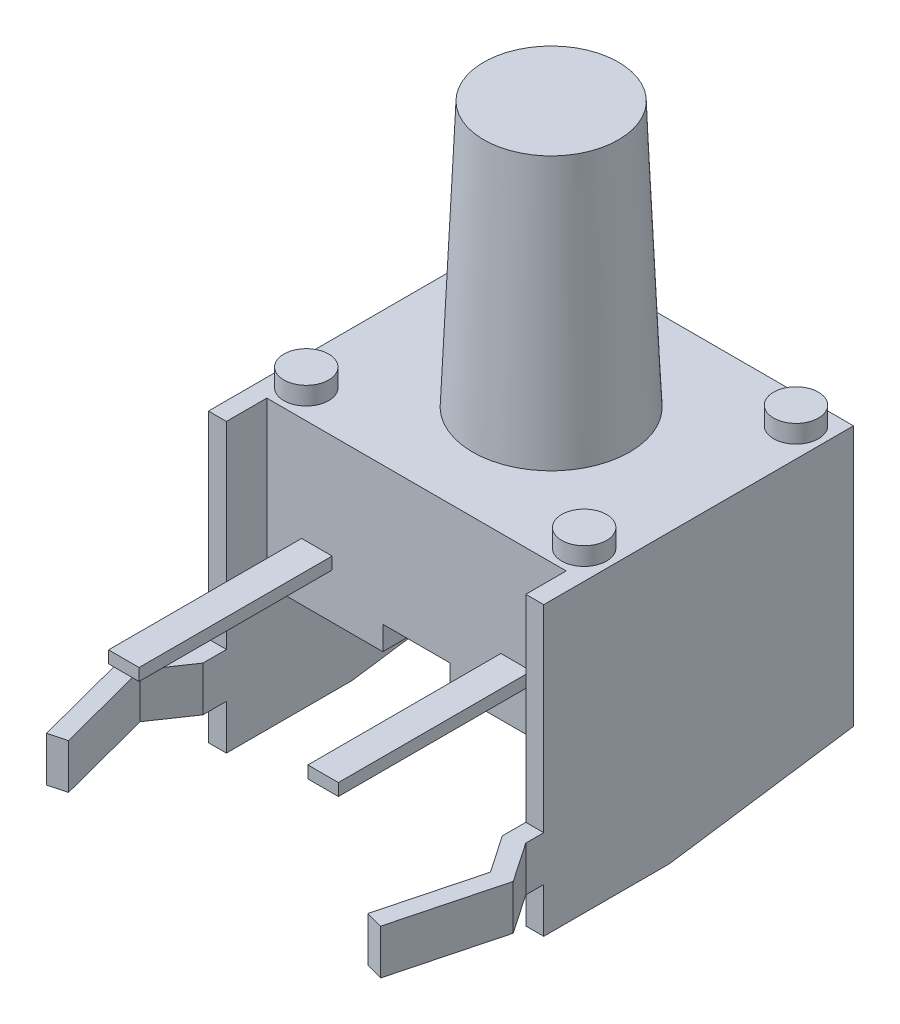
from build123d import *

# Parameters (mm, degrees)
SKETCH1_W           = 7
SKETCH1_H           = 6
BOSS_EXTRUDE1_DEPTH = 5.05
SKETCH3_W           = 0.68
SKETCH3_H           = 0.27
BOSS_EXTRUDE2_DEPTH = 4.3
SKETCH4_W           = 0.4
SKETCH4_H           = 5.8
BOSS_EXTRUDE3_DEPTH = 6.9
SKETCH6_W           = 6.67
SKETCH6_H           = 1.45
CUT_EXTRUDE1_DEPTH  = 13.06410896
CUT_EXTRUDE2_REACH  = 10.686
SKETCH7_W           = 1.5
SKETCH7_H           = 0.53
BOSS_EXTRUDE5_START = -3.6
SKETCH9_R           = 0.5
BOSS_EXTRUDE5_DEPTH = 4
BOSS_EXTRUDE6_DEPTH = 0.4
BOSS_EXTRUDE4_START = -1
BOSS_EXTRUDE4_DEPTH = 1


with BuildPart() as part:
    # Sketch1 → Boss-Extrude1 (new body)
    with BuildSketch(Plane(origin=(0, 0, 0), x_dir=(1, 0, 0), z_dir=(0, 1, 0))):
        Rectangle(SKETCH1_W, SKETCH1_H)
    extrude(amount=BOSS_EXTRUDE1_DEPTH)

    # Sketch3 → Boss-Extrude2 (add)
    with BuildSketch(Plane.XY.offset(3)):
        with Locations((-2.22, 2.595)):
            Rectangle(SKETCH3_W, SKETCH3_H)
        with Locations((2.22, 2.595)):
            Rectangle(SKETCH3_W, SKETCH3_H)
    extrude(amount=BOSS_EXTRUDE2_DEPTH)

    # Sketch4 → Boss-Extrude3 (add)
    with BuildSketch(Plane(origin=(0, 0, -3), x_dir=(-1, 0, 0), z_dir=(0, 0, -1))):
        with Locations((-3.535, 2.15)):
            Rectangle(SKETCH4_W, SKETCH4_H)
        with Locations((3.535, 2.15)):
            Rectangle(SKETCH4_W, SKETCH4_H)
    extrude(amount=-BOSS_EXTRUDE3_DEPTH)

    # Sketch6 → Cut-Extrude1 (cut, through all)
    with BuildSketch(Plane(origin=(0, 0, -3), x_dir=(-1, 0, 0), z_dir=(0, 0, -1))):
        with Locations((0, 0.725)):
            Rectangle(SKETCH6_W, SKETCH6_H)
    extrude(amount=-CUT_EXTRUDE1_DEPTH, mode=Mode.SUBTRACT)

    # Sketch7 → Cut-Extrude2 (cut, up to next)
    with BuildSketch(Plane.XY.offset(3), mode=Mode.PRIVATE) as cut_extrude2_sk1:
        with Locations((0, 1.715)):
            Rectangle(SKETCH7_W, SKETCH7_H)
    cut_extrude2_tool1 = extrude(cut_extrude2_sk1.sketch, amount=-CUT_EXTRUDE2_REACH, mode=Mode.PRIVATE) & part.part
    add(cut_extrude2_tool1.solids().sort_by_distance((0, 1.715, 3))[0], mode=Mode.SUBTRACT)

    # Sketch9 → Boss-Extrude5 (add)
    with BuildSketch(Plane(origin=(0, 5.05, 0), x_dir=(1, 0, 0), z_dir=(0, 1, 0)).offset(BOSS_EXTRUDE5_START)):
        with Locations(Location((-3.095, 2.36, 0), (0, 0, 90))):
            Circle(SKETCH9_R)
        with Locations(Location((-3.095, -2.36, 0), (0, 0, 90))):
            Circle(SKETCH9_R)
        with Locations(Location((3.095, 2.36, 0), (0, 0, 90))):
            Circle(SKETCH9_R)
        with Locations(Location((3.095, -2.36, 0), (0, 0, 90))):
            Circle(SKETCH9_R)
    extrude(amount=BOSS_EXTRUDE5_DEPTH)

    # Sketch2 → Revolve1 (revolve)
    with BuildSketch(Plane.XY):
        Polygon((0, 5.05), (0, 10.95), (1.5, 10.95), (1.75, 5.05), align=None)
    revolve(axis=Axis((0, 5.05, 0), (0, 1, 0)))

    # Sketch10 → Boss-Extrude6 (add)
    with BuildSketch(Plane.ZY.offset(3.735)):
        Polygon((3.9, -0.75), (3.9, -1.35), (1.1, -1.35), (-3, -0.75), align=None)
    boss_extrude6 = extrude(amount=-BOSS_EXTRUDE6_DEPTH)

    # Sketch8 → Boss-Extrude4 (add)
    with BuildSketch(Plane.XZ.offset(1.35).offset(BOSS_EXTRUDE4_START)):
        Polygon((-3.735, 3.9), (-3.735, 4.3), (-4.335, 5.18), (-3.721940695, 7.52), (-3.335, 7.41862496), (-3.901894327, 5.254833117), (-3.335, 4.423388104), (-3.335, 3.9), align=None)
    boss_extrude4 = extrude(amount=-BOSS_EXTRUDE4_DEPTH)

    # Mirror1: Boss-Extrude6, Boss-Extrude4 across plane
    add(boss_extrude6.mirror(Plane(origin=(0, 0, 0), x_dir=(0, 0, 1), z_dir=(1, 0, 0))))
    add(boss_extrude4.mirror(Plane(origin=(0, 0, 0), x_dir=(0, 0, 1), z_dir=(1, 0, 0))))


solid = part.part
